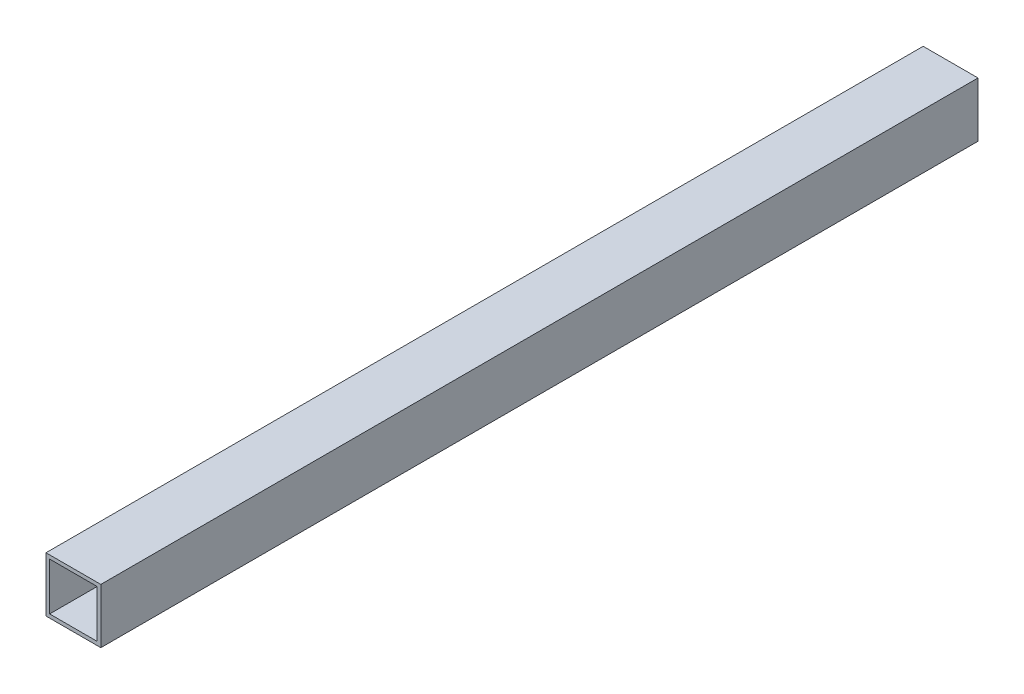
from build123d import *

# Parameters (mm, degrees)
SKETCH1_W           = 19.05
SKETCH1_H           = 19.05
SKETCH1_W_2         = 16.51
SKETCH1_H_2         = 16.51
BOSS_EXTRUDE1_DEPTH = 1524
SKETCH2_W           = 2743.2
SKETCH2_H           = 19.05
CUT_EXTRUDE1_DEPTH  = 1525.148820859


with BuildPart() as part:
    # Sketch1 → Boss-Extrude1 (new, symmetric)
    with BuildSketch(Plane.XY):
        Rectangle(SKETCH1_W, SKETCH1_H)
        Rectangle(SKETCH1_W_2, SKETCH1_H_2, mode=Mode.SUBTRACT)
    extrude(amount=BOSS_EXTRUDE1_DEPTH, both=True)

    # Sketch2 → Cut-Extrude1 (cut, through all)
    with BuildSketch(Plane(origin=(9.525, 0, 0), x_dir=(0, 0, -1), z_dir=(1, 0, 0))):
        with Locations((-152.4, 0)):
            Rectangle(SKETCH2_W, SKETCH2_H)
    extrude(amount=-CUT_EXTRUDE1_DEPTH, mode=Mode.SUBTRACT)


solid = part.part
